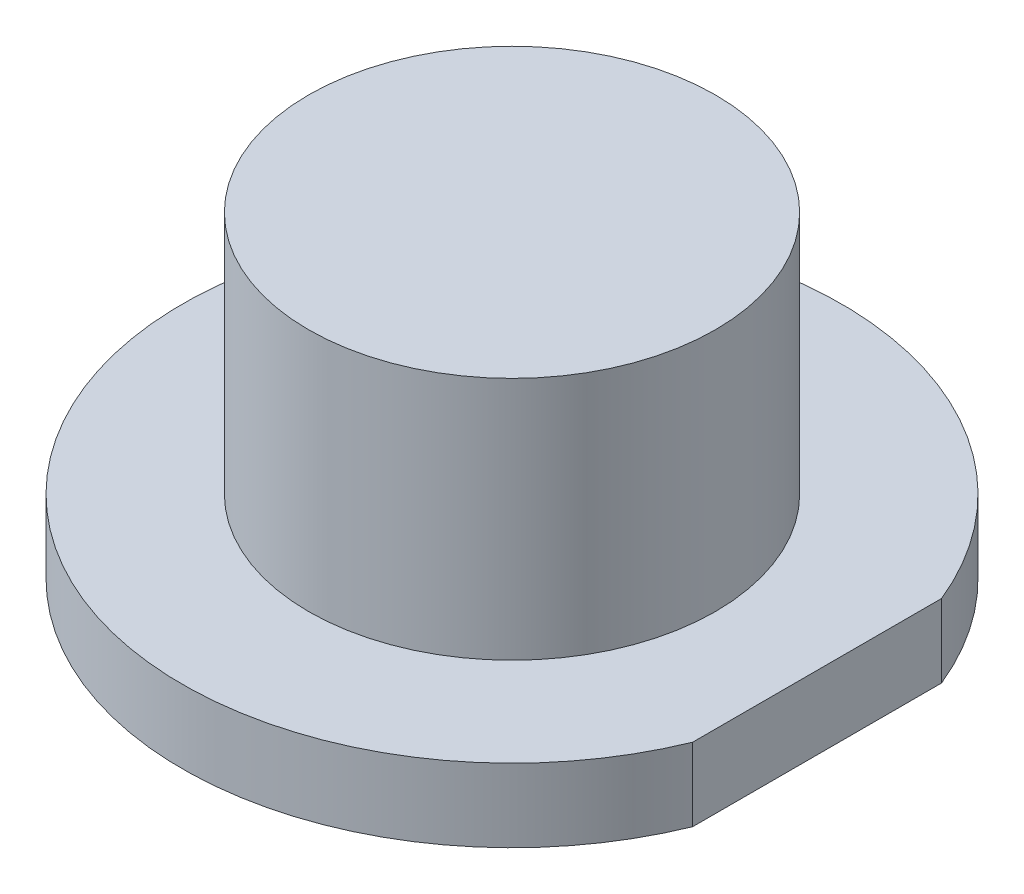
from build123d import *

# Parameters (mm, degrees)
SKETCH1_R           = 4.05
BOSS_EXTRUDE1_DEPTH = 0.9
CUT_EXTRUDE1_START  = -0.9
CUT_EXTRUDE1_DEPTH  = 0.9
SKETCH3_R           = 2.5
BOSS_EXTRUDE2_DEPTH = 3
CUT_EXTRUDE3_DEPTH  = 2.5
CUT_EXTRUDE4_DEPTH  = 0.25


with BuildPart() as part:
    # Sketch1 → Boss-Extrude1 (new body)
    with BuildSketch(Plane(origin=(0, 0, 0), x_dir=(1, 0, 0), z_dir=(0, 1, 0))):
        Circle(SKETCH1_R)
    extrude(amount=BOSS_EXTRUDE1_DEPTH)

    # Sketch2 → Cut-Extrude1 (cut)
    with BuildSketch(Plane(origin=(0, 0.9, 0), x_dir=(1, 0, 0), z_dir=(0, 1, 0)).offset(CUT_EXTRUDE1_START)):
        with BuildLine():
            Line((3.75, 1.529705854), (3.75, 0))
            Line((3.75, 0), (3.75, -1.529705854))
            ThreePointArc((3.75, -1.529705854), (3.97429239, -0.779422863), (4.05, 0))
            ThreePointArc((4.05, 0), (3.97429239, 0.779422863), (3.75, 1.529705854))
        make_face()
    extrude(amount=CUT_EXTRUDE1_DEPTH, mode=Mode.SUBTRACT)

    # Sketch3 → Boss-Extrude2 (add)
    with BuildSketch(Plane(origin=(0, 0.9, 0), x_dir=(1, 0, 0), z_dir=(0, 1, 0))):
        Circle(SKETCH3_R)
    extrude(amount=BOSS_EXTRUDE2_DEPTH)

    # Sketch4 → Cut-Extrude3 (cut)
    with BuildSketch(Plane.XZ):
        with BuildLine():
            Line((-1.984313483, 0.25), (-0.25, 0.25))
            Line((-0.25, 0.25), (-0.25, 1.984313483))
            ThreePointArc((-0.25, 1.984313483), (-1.414213562, 1.414213562), (-1.984313483, 0.25))
        make_face()
        with BuildLine():
            Line((0.25, 1.984313483), (0.25, 0.25))
            Line((0.25, 0.25), (1.984313483, 0.25))
            ThreePointArc((1.984313483, 0.25), (1.414213562, 1.414213562), (0.25, 1.984313483))
        make_face()
        with BuildLine():
            Line((-0.25, -1.984313483), (-0.25, -0.25))
            Line((-0.25, -0.25), (-1.984313483, -0.25))
            ThreePointArc((-1.984313483, -0.25), (-1.414213562, -1.414213562), (-0.25, -1.984313483))
        make_face()
    extrude(amount=-CUT_EXTRUDE3_DEPTH, mode=Mode.SUBTRACT)

    # Sketch4<3> → Cut-Extrude4 (cut)
    with BuildSketch(Plane.XZ):
        with BuildLine():
            Line((1.984313483, -0.25), (0.25, -0.25))
            Line((0.25, -0.25), (0.25, -1.984313483))
            ThreePointArc((0.25, -1.984313483), (1.414213562, -1.414213562), (1.984313483, -0.25))
        make_face()
    extrude(amount=-CUT_EXTRUDE4_DEPTH, mode=Mode.SUBTRACT)


solid = part.part
